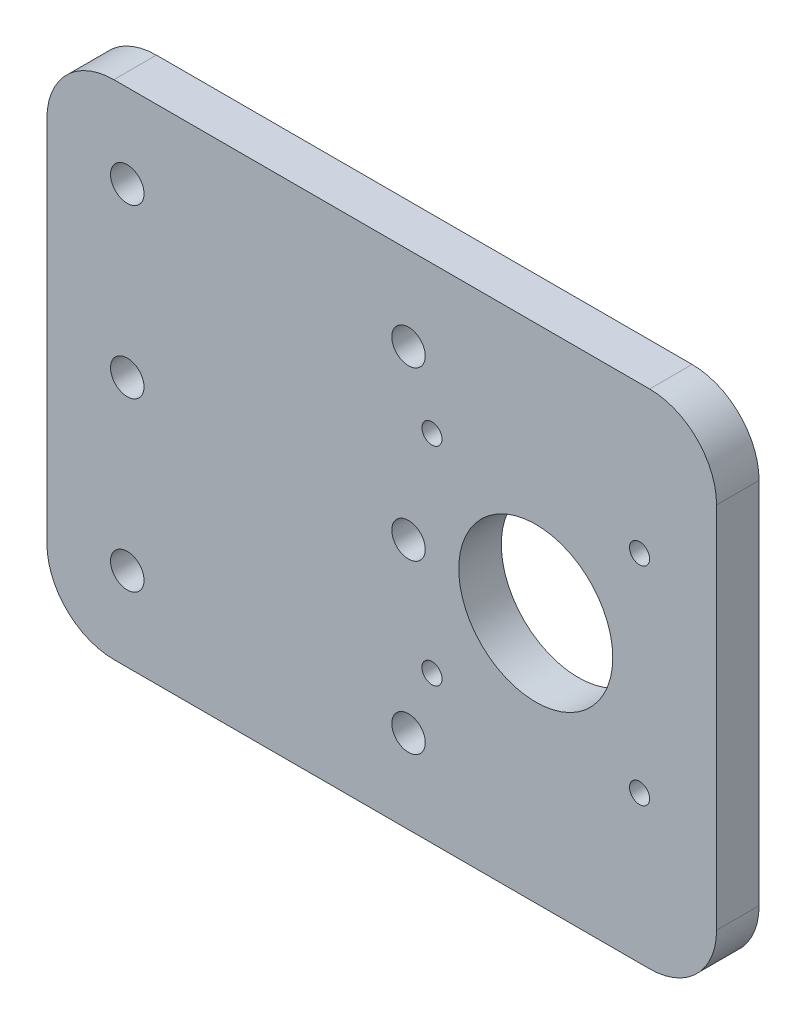
from build123d import *

# Parameters (mm, degrees)
SKETCH1_W             = 100
SKETCH1_H             = 75
PLATE_DEPTH           = 6.35
SKETCH2_R             = 2.5
CUT_IDLER_HOLES_DEPTH = 126.161186076
SKETCH3_R             = 1.5
SKETCH3_R_2           = 11.5
CUT_MOTOR_HOLES_DEPTH = 126.161186076
CHAMFER1_SIZE         = 1.5
FILLET1_R             = 10


with BuildPart() as part:
    # Sketch1 → plate (new body)
    with BuildSketch(Plane.XY):
        with Locations((50, 37.5)):
            Rectangle(SKETCH1_W, SKETCH1_H)
    extrude(amount=PLATE_DEPTH)

    # Sketch2 → cut idler holes (cut, through all)
    with BuildSketch(Plane.XY.offset(6.35)):
        with Locations((12, 62.5)):
            Circle(SKETCH2_R)
        with Locations((12, 12.5)):
            Circle(SKETCH2_R)
        with Locations((54, 37.5)):
            Circle(SKETCH2_R)
        with Locations((54, 62.5)):
            Circle(SKETCH2_R)
        with Locations((12, 37.5)):
            Circle(SKETCH2_R)
        with Locations((54, 12.5)):
            Circle(SKETCH2_R)
    extrude(amount=-CUT_IDLER_HOLES_DEPTH, mode=Mode.SUBTRACT)

    # Sketch3 → cut motor holes (cut, through all)
    with BuildSketch(Plane.XY.offset(6.35)):
        with Locations((57.5, 53)):
            Circle(SKETCH3_R)
        with Locations((88.5, 53)):
            Circle(SKETCH3_R)
        with Locations((88.5, 22)):
            Circle(SKETCH3_R)
        with Locations((57.5, 22)):
            Circle(SKETCH3_R)
        with Locations((73, 37.5)):
            Circle(SKETCH3_R_2)
    extrude(amount=-CUT_MOTOR_HOLES_DEPTH, mode=Mode.SUBTRACT)

    # Chamfer1
    chamfer1_edges = [part.edges().sort_by_distance(p)[0] for p in [
        (56, 53, 0),
        (87, 22, 0),
        (56, 22, 0),
        (87, 53, 0),
    ]]
    chamfer(chamfer1_edges, length=CHAMFER1_SIZE)

    # Fillet1
    fillet1_edges = [part.edges().sort_by_distance(p)[0] for p in [
        (0, 75, 3.175),
        (100, 75, 3.175),
        (100, 0, 3.175),
        (0, 0, 3.175),
    ]]
    fillet(fillet1_edges, radius=FILLET1_R)


solid = part.part
